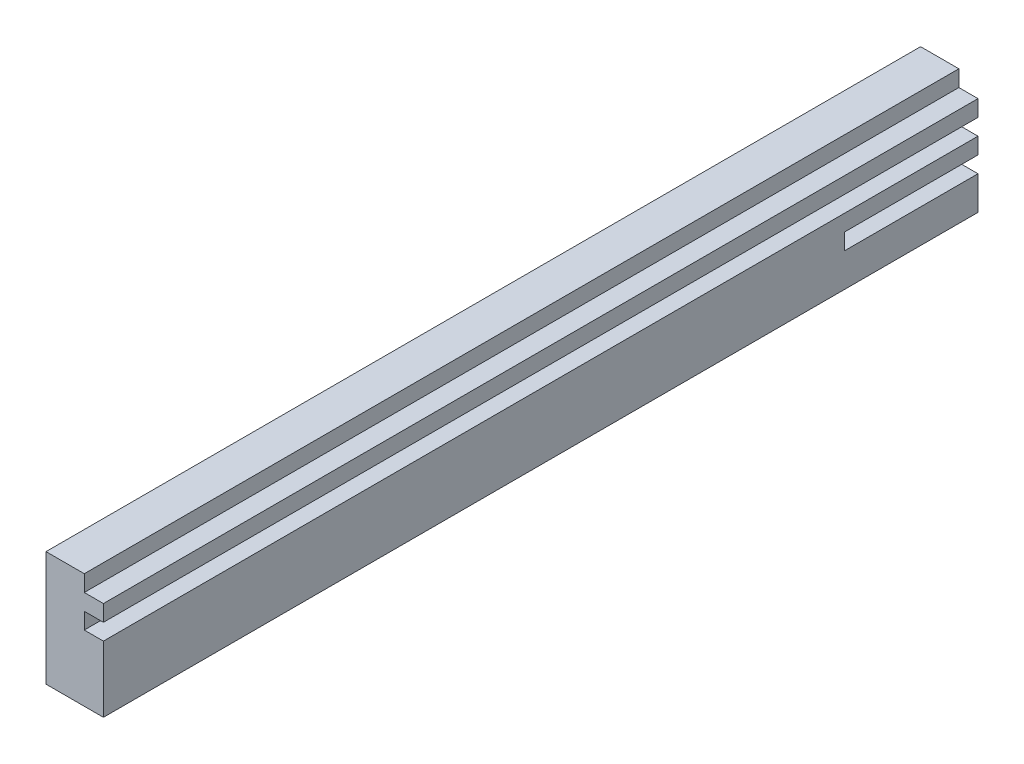
from build123d import *

# Parameters (mm, degrees)
SKETCH1_W           = 457
SKETCH1_H           = 60
BOSS_EXTRUDE1_DEPTH = 30
SKETCH2_W           = 457
SKETCH2_H           = 8.5
SKETCH2_W_2         = 69.888451377
CUT_EXTRUDE1_DEPTH  = 10


with BuildPart() as part:
    # Sketch1 → Boss-Extrude1 (new body)
    with BuildSketch(Plane(origin=(0, 0, 0), x_dir=(0, 0, -1), z_dir=(1, 0, 0))):
        with Locations((228.5, 30)):
            Rectangle(SKETCH1_W, SKETCH1_H)
    extrude(amount=BOSS_EXTRUDE1_DEPTH)

    # Sketch2 → Cut-Extrude1 (cut)
    with BuildSketch(Plane(origin=(30, 0, 0), x_dir=(0, 0, -1), z_dir=(1, 0, 0))):
        with Locations((228.5, 55.75)):
            Rectangle(SKETCH2_W, SKETCH2_H)
        with Locations((228.5, 38.75)):
            Rectangle(SKETCH2_W, SKETCH2_H)
        with Locations((422.055774312, 21.75)):
            Rectangle(SKETCH2_W_2, SKETCH2_H)
    extrude(amount=-CUT_EXTRUDE1_DEPTH, mode=Mode.SUBTRACT)


solid = part.part
